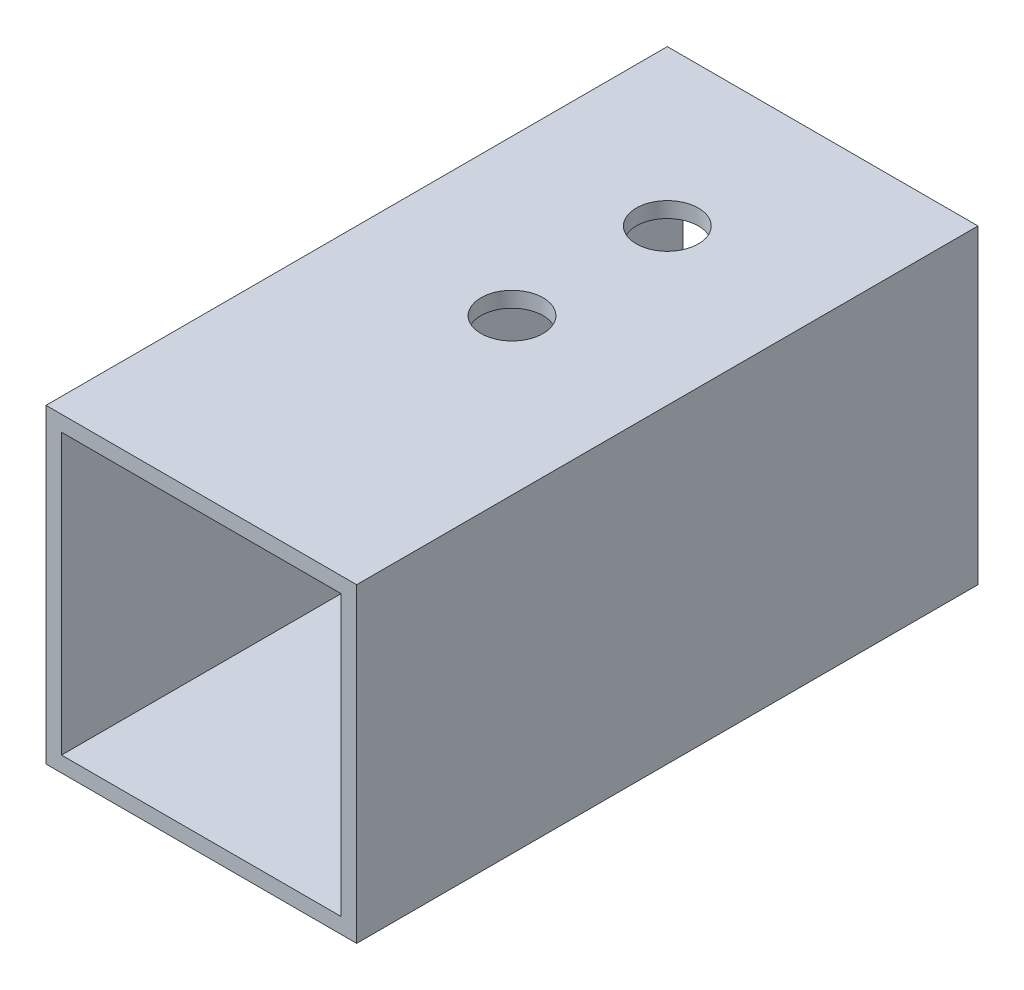
from build123d import *

# Parameters (mm, degrees)
SKETCH1_W           = 40
SKETCH1_H           = 40
SKETCH1_W_2         = 36
SKETCH1_H_2         = 36
BOSS_EXTRUDE1_DEPTH = 80
CUT_EXTRUDE1_REACH  = 93.652
SKETCH2_R           = 4
CUT_EXTRUDE2_REACH  = 93.652
SKETCH3_R           = 4


with BuildPart() as part:
    # Sketch1 → Boss-Extrude1 (new body)
    with BuildSketch(Plane.XY):
        Rectangle(SKETCH1_W, SKETCH1_H)
        Rectangle(SKETCH1_W_2, SKETCH1_H_2, mode=Mode.SUBTRACT)
    extrude(amount=BOSS_EXTRUDE1_DEPTH)

    # Sketch2 → Cut-Extrude1 (cut, up to next)
    with BuildSketch(Plane(origin=(0, 20, 0), x_dir=(1, 0, 0), z_dir=(0, 1, 0)), mode=Mode.PRIVATE) as cut_extrude1_sk1:
        with Locations(Location((0, -20, 0), (0, 0, 270))):
            Circle(SKETCH2_R)
    cut_extrude1_tool1 = extrude(cut_extrude1_sk1.sketch, amount=-CUT_EXTRUDE1_REACH, mode=Mode.PRIVATE) & part.part
    # Sketch2 → Cut-Extrude1 (cut, up to next)
    with BuildSketch(Plane(origin=(0, 20, 0), x_dir=(1, 0, 0), z_dir=(0, 1, 0)), mode=Mode.PRIVATE) as cut_extrude1_sk2:
        with Locations(Location((0, -40, 0), (0, 0, 270))):
            Circle(SKETCH2_R)
    cut_extrude1_tool2 = extrude(cut_extrude1_sk2.sketch, amount=-CUT_EXTRUDE1_REACH, mode=Mode.PRIVATE) & part.part
    add(cut_extrude1_tool1.solids().sort_by_distance((0, 20, 20))[0], mode=Mode.SUBTRACT)
    add(cut_extrude1_tool2.solids().sort_by_distance((0, 20, 40))[0], mode=Mode.SUBTRACT)

    # Sketch3 → Cut-Extrude2 (cut, up to next)
    with BuildSketch(Plane.XZ.offset(20), mode=Mode.PRIVATE) as cut_extrude2_sk1:
        with Locations(Location((0, 20, 0), (0, 0, 90))):
            Circle(SKETCH3_R)
    cut_extrude2_tool1 = extrude(cut_extrude2_sk1.sketch, amount=-CUT_EXTRUDE2_REACH, mode=Mode.PRIVATE) & part.part
    add(cut_extrude2_tool1.solids().sort_by_distance((0, -20, 20))[0], mode=Mode.SUBTRACT)


solid = part.part
